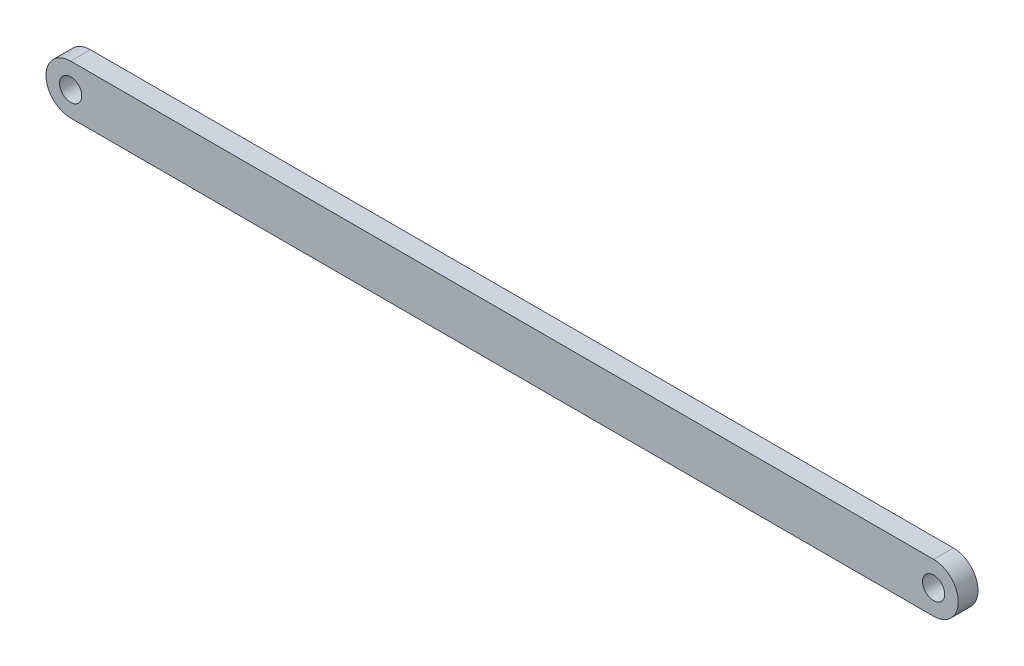
from build123d import *

# Parameters (mm, degrees)
SKETCH1_R           = 2.25
BOSS_EXTRUDE1_DEPTH = 2


with BuildPart() as part:
    # Sketch1 → Boss-Extrude1 (new, symmetric)
    with BuildSketch(Plane.XY):
        with BuildLine():
            Line((0, 5), (175, 5))
            ThreePointArc((175, 5), (180, 0), (175, -5))
            Line((175, -5), (0, -5))
            ThreePointArc((0, -5), (-5, 0), (0, 5))
        make_face()
        Circle(SKETCH1_R, mode=Mode.SUBTRACT)
        with Locations((175, 0)):
            Circle(SKETCH1_R, mode=Mode.SUBTRACT)
    extrude(amount=BOSS_EXTRUDE1_DEPTH, both=True)


solid = part.part
